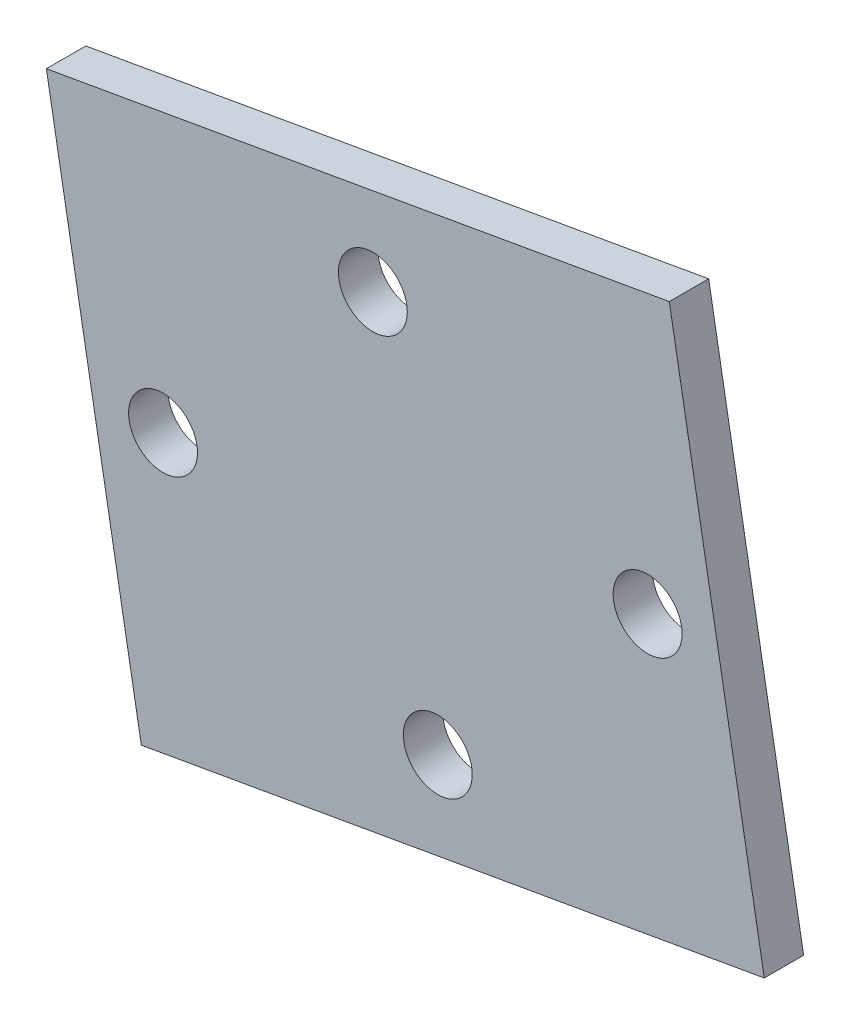
from build123d import *

# Parameters (mm, degrees)
SKETCH1_W           = 32.13640153
SKETCH1_H           = 27.772655408
SKETCH1_R           = 3
SKETCH1_R_2         = 1.75
BOSS_EXTRUDE1_DEPTH = 1


with BuildPart() as part:
    # Sketch1 → Boss-Extrude1 (new, symmetric)
    # profile 1 of 5: a face of its own
    with BuildSketch(Plane(origin=(0, 0, 0), x_dir=(-0.9848077530122068, -0.17364817766693766, 0), z_dir=(0, 0, 1))):
        Rectangle(SKETCH1_W, SKETCH1_H)
        with Locations((0, -9.5)):
            Circle(SKETCH1_R, mode=Mode.SUBTRACT)
        with Locations((12.5, 0)):
            Circle(SKETCH1_R, mode=Mode.SUBTRACT)
        with Locations((0, 9.5)):
            Circle(SKETCH1_R, mode=Mode.SUBTRACT)
        with Locations((-12.5, 0)):
            Circle(SKETCH1_R, mode=Mode.SUBTRACT)
    # profile 2 of 5: a face of its own
    with BuildSketch(Plane(origin=(0, 0, 0), x_dir=(-0.9848077530122068, -0.17364817766693766, 0), z_dir=(0, 0, 1))):
        with Locations((-12.5, 0)):
            Circle(SKETCH1_R)
        with Locations(Location((-12.5, 0, 0), (0, 0, 170))):
            Circle(SKETCH1_R_2, mode=Mode.SUBTRACT)
    # profile 3 of 5: a face of its own
    with BuildSketch(Plane(origin=(0, 0, 0), x_dir=(-0.9848077530122068, -0.17364817766693766, 0), z_dir=(0, 0, 1))):
        with Locations((0, -9.5)):
            Circle(SKETCH1_R)
        with Locations(Location((0, -9.5, 0), (0, 0, 170))):
            Circle(SKETCH1_R_2, mode=Mode.SUBTRACT)
    # profile 4 of 5: a face of its own
    with BuildSketch(Plane(origin=(0, 0, 0), x_dir=(-0.9848077530122068, -0.17364817766693766, 0), z_dir=(0, 0, 1))):
        with Locations((0, 9.5)):
            Circle(SKETCH1_R)
        with Locations(Location((0, 9.5, 0), (0, 0, 170))):
            Circle(SKETCH1_R_2, mode=Mode.SUBTRACT)
    # profile 5 of 5: a face of its own
    with BuildSketch(Plane(origin=(0, 0, 0), x_dir=(-0.9848077530122068, -0.17364817766693766, 0), z_dir=(0, 0, 1))):
        with Locations((12.5, 0)):
            Circle(SKETCH1_R)
        with Locations(Location((12.5, 0, 0), (0, 0, 170))):
            Circle(SKETCH1_R_2, mode=Mode.SUBTRACT)
    extrude(amount=BOSS_EXTRUDE1_DEPTH, both=True)


solid = part.part
